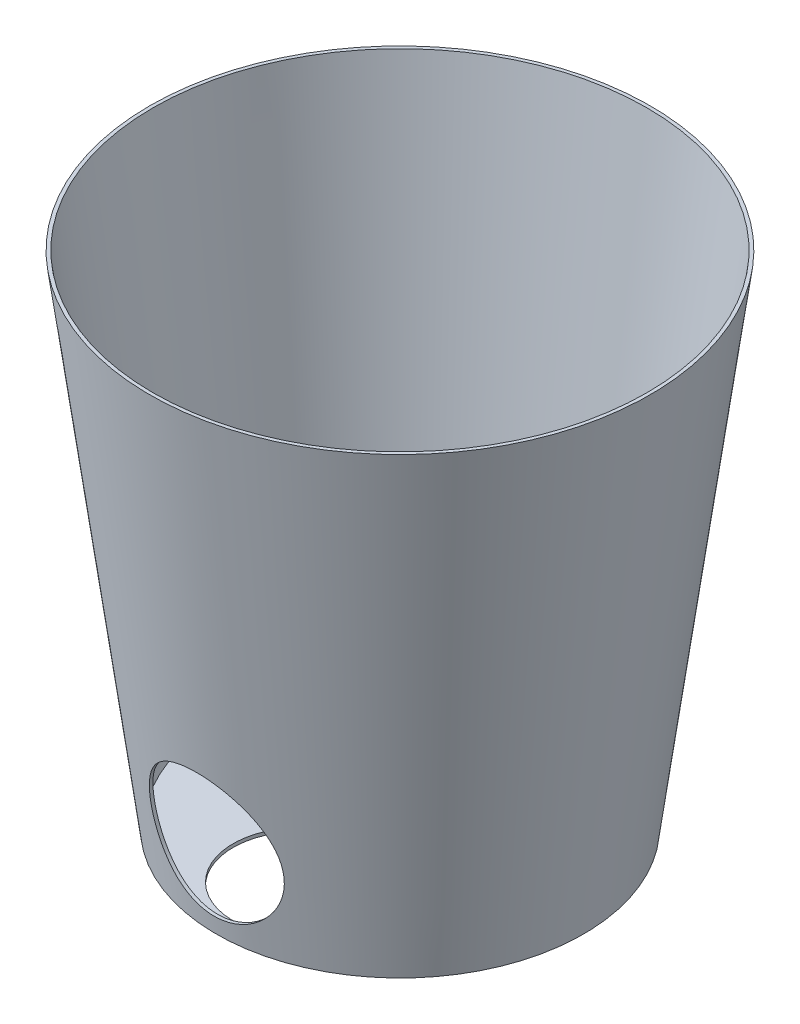
from build123d import *

# Parameters (mm, degrees)
SHELL_1_T           = -2
SKETCH_2_R          = 40
CUT_EXTRUDE_1_DEPTH = 368.423461417
SKETCH_3_R          = 40
CUT_EXTRUDE_7_DEPTH = 10


with BuildPart() as part:
    # 草圖1 → 旋轉1 (revolve)
    with BuildSketch(Plane.XY):
        Polygon((-150, 300), (-110, 0), (0, 0), (0, 300), align=None)
    revolve(axis=Axis((0, 300, 0), (0, -1, 0)))

    # 薄殼1
    shell_1_openings = [part.faces().sort_by_distance(p)[0] for p in [
        (0, 300, 0),
    ]]
    offset(amount=SHELL_1_T, openings=shell_1_openings, kind=Kind.INTERSECTION)

    # 草圖2 → 除料-伸長1 (cut, through all)
    with BuildSketch(Plane.XY):
        with Locations(Location((0, 50, 0), (0, 0, 223.831442038))):
            Circle(SKETCH_2_R)
    extrude(amount=CUT_EXTRUDE_1_DEPTH, mode=Mode.SUBTRACT)

    # 草圖3 → 除料-伸長7 (cut)
    with BuildSketch(Plane(origin=(0, 0, 0), x_dir=(1, 0, 0), z_dir=(0, 1, 0))):
        with Locations((0, -60)):
            Circle(SKETCH_3_R)
    extrude(amount=CUT_EXTRUDE_7_DEPTH, mode=Mode.SUBTRACT)


solid = part.part
